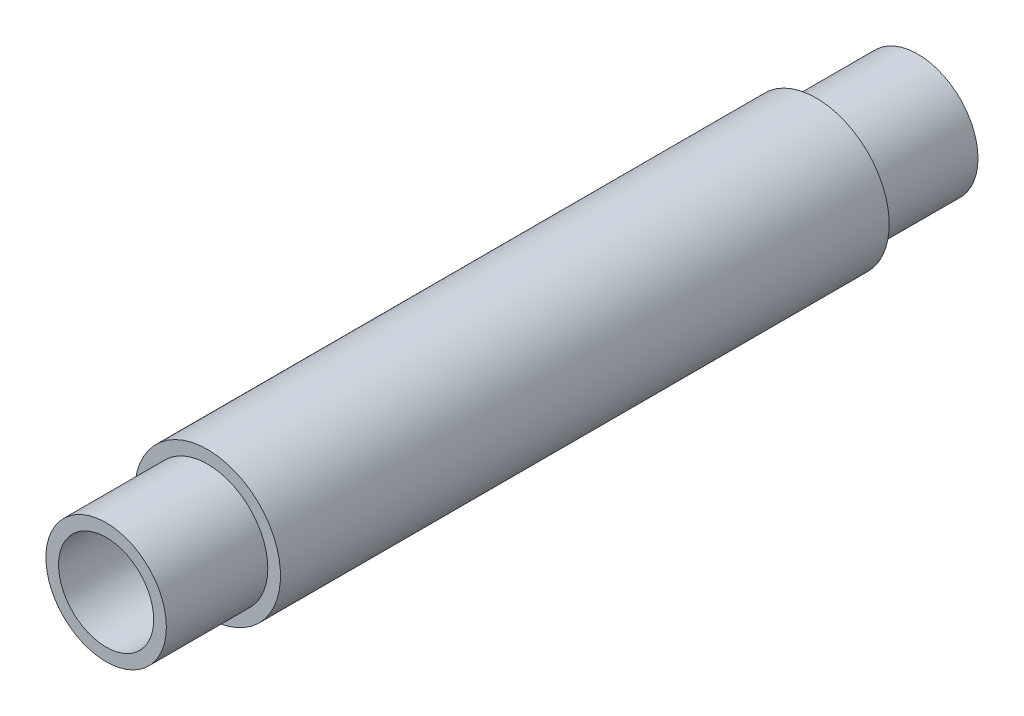
from build123d import *

# Parameters (mm, degrees)
SKETCH1_R           = 15.08125
SKETCH1_R_2         = 11.90625
BOSS_EXTRUDE1_DEPTH = 101.6
SKETCH2_R           = 18.25625
SKETCH2_R_2         = 11.90625
BOSS_EXTRUDE2_DEPTH = 76.2


with BuildPart() as part:
    # Sketch1 → Boss-Extrude1 (new, symmetric)
    with BuildSketch(Plane.XY):
        Circle(SKETCH1_R)
        Circle(SKETCH1_R_2, mode=Mode.SUBTRACT)
    extrude(amount=BOSS_EXTRUDE1_DEPTH, both=True)

    # Sketch2 → Boss-Extrude2 (add, symmetric)
    with BuildSketch(Plane.XY):
        with Locations(Location((0, 0, 0), (0, 0, 180))):
            Circle(SKETCH2_R)
        Circle(SKETCH2_R_2, mode=Mode.SUBTRACT)
    extrude(amount=BOSS_EXTRUDE2_DEPTH, both=True)


solid = part.part
